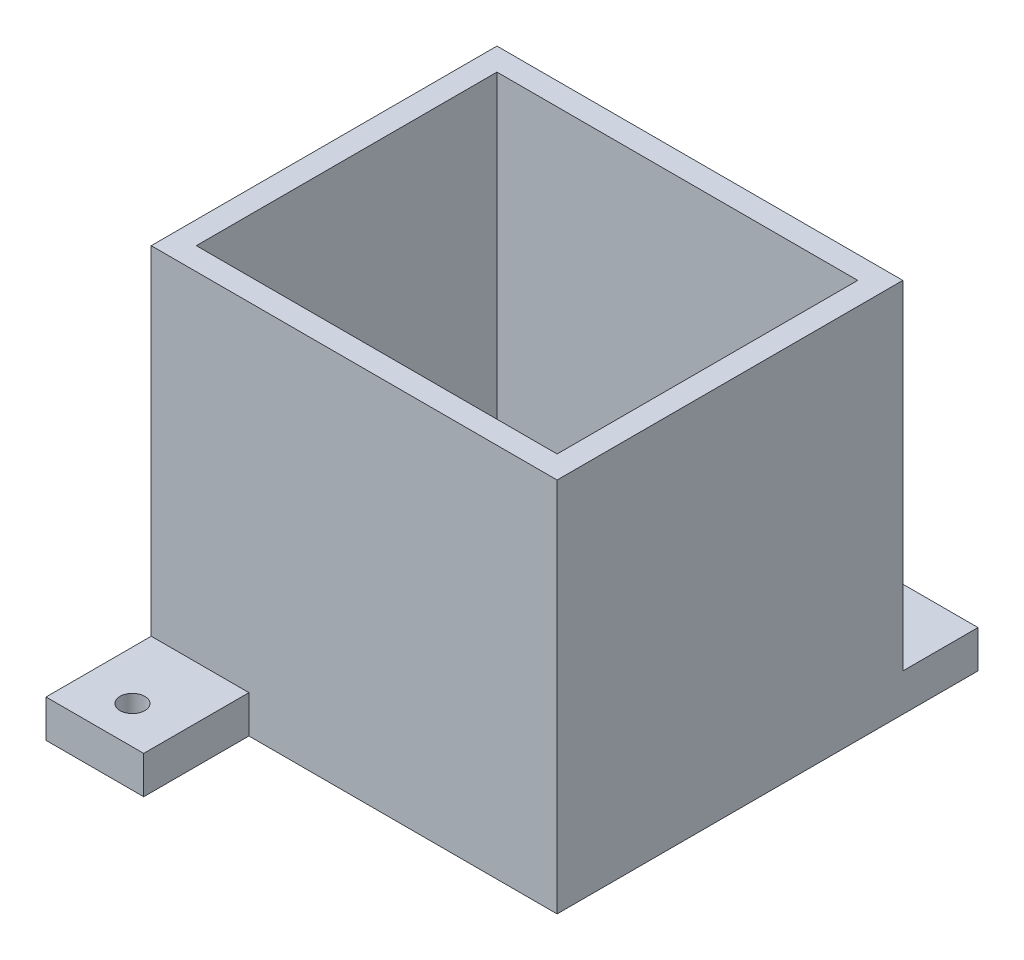
from build123d import *

# Parameters (mm, degrees)
SKETCH1_W           = 54
SKETCH1_H           = 46
SKETCH1_W_2         = 48
SKETCH1_H_2         = 40
BOSS_EXTRUDE1_DEPTH = 50
SKETCH2_W           = 54
SKETCH2_H           = 10
SKETCH2_R           = 1.65
SKETCH2_W_2         = 13
SKETCH2_H_2         = 14
BOSS_EXTRUDE2_DEPTH = 5


with BuildPart() as part:
    # Sketch1 → Boss-Extrude1 (new body)
    with BuildSketch(Plane(origin=(0, 0, 0), x_dir=(1, 0, 0), z_dir=(0, 1, 0))):
        with Locations((2.264566872, 0.439206794)):
            Rectangle(SKETCH1_W, SKETCH1_H)
        with Locations((2.264566872, 0.439206794)):
            Rectangle(SKETCH1_W_2, SKETCH1_H_2, mode=Mode.SUBTRACT)
    extrude(amount=BOSS_EXTRUDE1_DEPTH)

    # Sketch2 → Boss-Extrude2 (add)
    # profile 1 of 2: a face of its own
    with BuildSketch(Plane(origin=(0, 0, 0), x_dir=(1, 0, 0), z_dir=(0, 1, 0))):
        with Locations((2.264566872, 28.439206794)):
            Rectangle(SKETCH2_W, SKETCH2_H)
        with Locations(Location((-18.235433128, 28.439206794, 0), (0, 0, 270))):
            Circle(SKETCH2_R, mode=Mode.SUBTRACT)
        with Locations(Location((1.764566872, 28.439206794, 0), (0, 0, 270))):
            Circle(SKETCH2_R, mode=Mode.SUBTRACT)
        with Locations(Location((21.764566872, 28.439206794, 0), (0, 0, 270))):
            Circle(SKETCH2_R, mode=Mode.SUBTRACT)
    # profile 2 of 2: a face of its own
    with BuildSketch(Plane(origin=(0, 0, 0), x_dir=(1, 0, 0), z_dir=(0, 1, 0))):
        with Locations((-18.235433128, -29.560793206)):
            Rectangle(SKETCH2_W_2, SKETCH2_H_2)
        with Locations(Location((-18.235433128, -31.560793206, 0), (0, 0, 270))):
            Circle(SKETCH2_R, mode=Mode.SUBTRACT)
    extrude(amount=BOSS_EXTRUDE2_DEPTH)


solid = part.part
